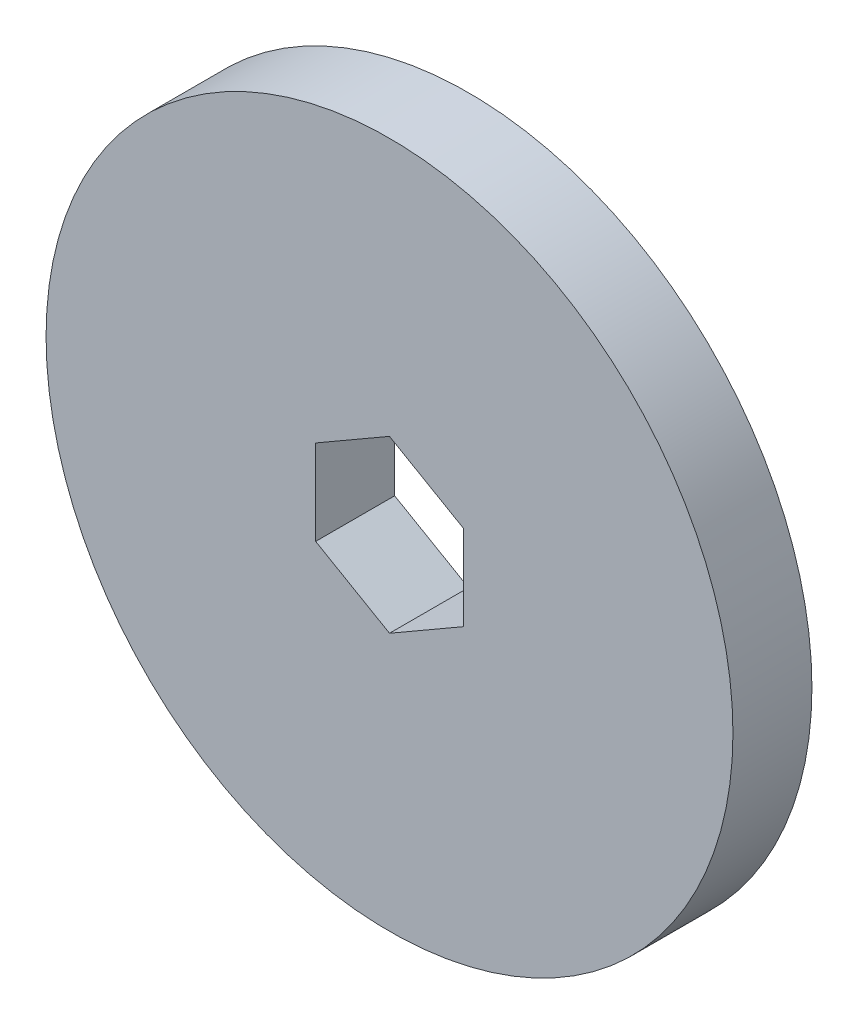
from build123d import *

# Parameters (mm, degrees)
SKETCH1_R           = 25.4
BOSS_EXTRUDE1_DEPTH = 5.842


with BuildPart() as part:
    # Sketch1 → Boss-Extrude1 (new body)
    with BuildSketch(Plane.XY):
        Circle(SKETCH1_R)
        Polygon((0, -6.30581964), (5.461, -3.15290982), (5.461, 3.15290982), (0, 6.30581964), (-5.461, 3.15290982), (-5.461, -3.15290982), align=None, mode=Mode.SUBTRACT)
    extrude(amount=BOSS_EXTRUDE1_DEPTH)


solid = part.part
